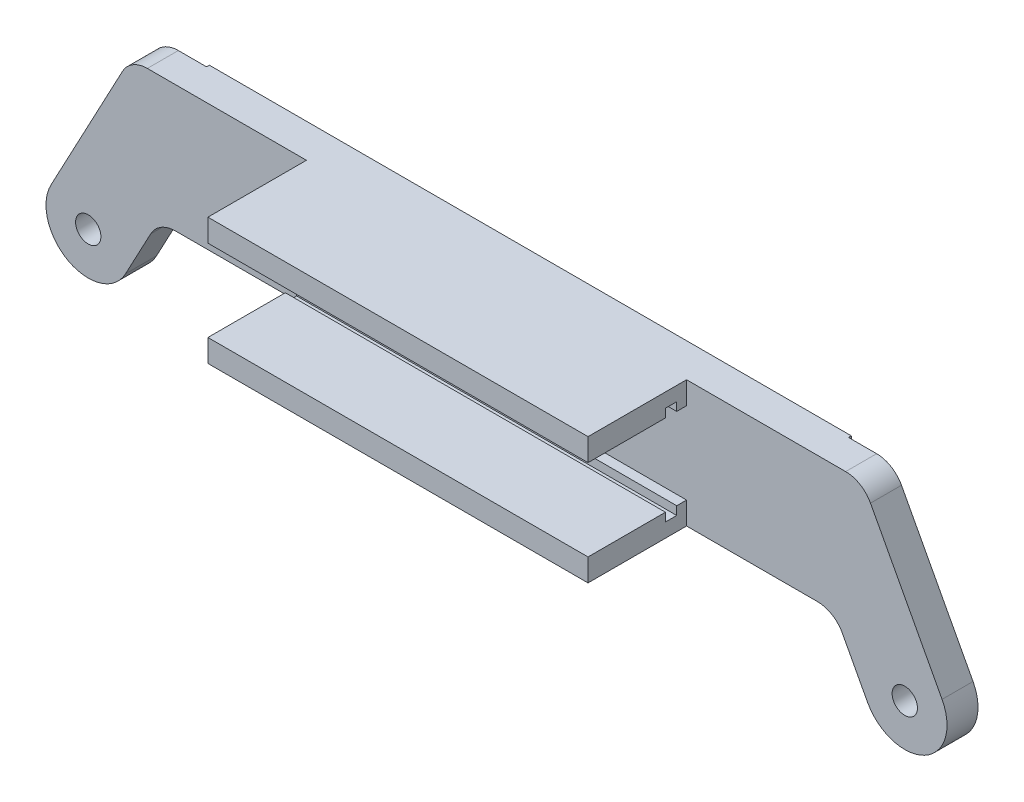
from build123d import *

# Parameters (mm, degrees)
SKETCH_1_W          = 220
SKETCH_1_H          = 45
EXTRUDE_1_DEPTH     = 6
EXTRUDE_2_DEPTH     = 35
SKETCH_5_W          = 4
SKETCH_5_H          = 3
CUT_EXTRUDE_3_DEPTH = 194.244663574
SKETCH_6_W          = 220
SKETCH_6_H          = 45
EXTRUDE_3_DEPTH     = 5
EXTRUDE_4_DEPTH     = 11
SKETCH_10_R         = 4.5
CUT_EXTRUDE_4_DEPTH = 172.992005628
FILLET_1_R          = 10
SKETCH_11_W         = 10
SKETCH_11_H         = 8
CUT_EXTRUDE_6_DEPTH = 35
SKETCH_18_W         = 228
SKETCH_18_H         = 45
EXTRUDE_5_DEPTH     = 1


with BuildPart() as part:
    # 草图1 → 凸台-拉伸1 (new body)
    with BuildSketch(Plane.XY):
        Rectangle(SKETCH_1_W, SKETCH_1_H)
    extrude(amount=EXTRUDE_1_DEPTH)

    # 草图2 → 凸台-拉伸2 (add)
    with BuildSketch(Plane.XY.offset(6)):
        Polygon((-77.5, 22.5), (77.5, 22.5), (77.5, 14.5), (75, 14.5), (-75, 14.5), (-77.5, 14.5), align=None)
        Polygon((-75, -14.5), (75, -14.5), (77.5, -14.5), (77.5, -22.5), (-77.5, -22.5), (-77.5, -14.5), align=None)
    extrude(amount=EXTRUDE_2_DEPTH)

    # 草图5 → 切除-拉伸3 (cut, through all)
    with BuildSketch(Plane.ZY.offset(77.5)):
        with Locations((11.5, -16)):
            Rectangle(SKETCH_5_W, SKETCH_5_H)
        with Locations((11.5, 16)):
            Rectangle(SKETCH_5_W, SKETCH_5_H)
    extrude(amount=-CUT_EXTRUDE_3_DEPTH, mode=Mode.SUBTRACT)

    # 草图6 → 凸台-拉伸3 (add)
    with BuildSketch(Plane(origin=(0, 0, 0), x_dir=(-1, 0, 0), z_dir=(0, 0, -1))):
        Rectangle(SKETCH_6_W, SKETCH_6_H)
    extrude(amount=EXTRUDE_3_DEPTH)

    # 草图9 → 凸台-拉伸4 (add)
    with BuildSketch(Plane(origin=(0, 0, -5), x_dir=(-1, 0, 0), z_dir=(0, 0, -1))):
        with BuildLine():
            Line((-110, -22.5), (-110, 22.5))
            Line((-110, 22.5), (-130, 22.5))
            Line((-130, 22.5), (-158.235294118, -30.441176471))
            ThreePointArc((-158.235294118, -30.441176471), (-152.058823529, -50.735294118), (-131.764705882, -44.558823529))
            Line((-131.764705882, -44.558823529), (-120, -22.5))
            Line((-120, -22.5), (-110, -22.5))
        make_face()
    extrude_4 = extrude(amount=-EXTRUDE_4_DEPTH)

    # 草图10 → 切除-拉伸4 (cut, through all)
    with BuildSketch(Plane.XY.offset(6)):
        with Locations((145, -37.5)):
            Circle(SKETCH_10_R)
    cut_extrude_4 = extrude(amount=-CUT_EXTRUDE_4_DEPTH, mode=Mode.SUBTRACT)

    # 镜向1: 凸台-拉伸4, 切除-拉伸4 across plane
    add(extrude_4.mirror(Plane(origin=(0, 0, 0), x_dir=(0, 0, 1), z_dir=(1, 0, 0))))
    add(cut_extrude_4.mirror(Plane(origin=(0, 0, 0), x_dir=(0, 0, 1), z_dir=(1, 0, 0))), mode=Mode.SUBTRACT)

    # 圆角1
    fillet_1_edges = [part.edges().sort_by_distance(p)[0] for p in [
        (-130, 22.5, 0.5),
        (-120, -22.5, 0.5),
        (130, 22.5, 0.5),
        (120, -22.5, 0.5),
    ]]
    fillet(fillet_1_edges, radius=FILLET_1_R)

    # 草图11 → 切除-拉伸6 (cut)
    with BuildSketch(Plane.XY.offset(41)):
        with Locations((-72.5, 18.5)):
            Rectangle(SKETCH_11_W, SKETCH_11_H)
        with Locations((72.5, 18.5)):
            Rectangle(SKETCH_11_W, SKETCH_11_H)
        with Locations((72.5, -18.5)):
            Rectangle(SKETCH_11_W, SKETCH_11_H)
        with Locations((-72.5, -18.5)):
            Rectangle(SKETCH_11_W, SKETCH_11_H)
    extrude(amount=-CUT_EXTRUDE_6_DEPTH, mode=Mode.SUBTRACT)

    # 草图18 → 凸台-拉伸5 (add)
    with BuildSketch(Plane(origin=(0, 0, -5), x_dir=(-1, 0, 0), z_dir=(0, 0, -1))):
        Rectangle(SKETCH_18_W, SKETCH_18_H)
    extrude(amount=EXTRUDE_5_DEPTH)


solid = part.part
